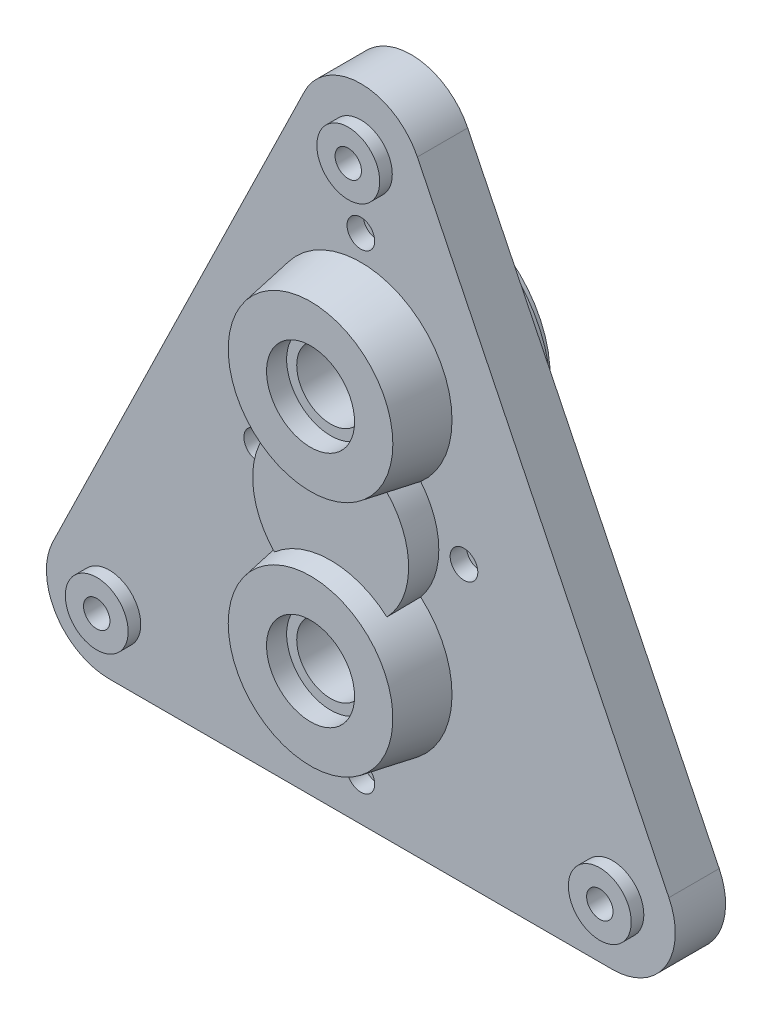
from build123d import *

# Parameters (mm, degrees)
SKETCH1_R                     = 5.25
BOSS_EXTRUDE1_DEPTH           = 20
BOSS_EXTRUDE2_DEPTH           = 10
BOSS_EXTRUDE3_DEPTH           = 15
SKETCH4_R                     = 36.25
BOSS_EXTRUDE4_DEPTH           = 20
BOSS_EXTRUDE4_DRAFT           = 10
BOSS_EXTRUDE4_PROFILE_2_DEPTH = 20
BOSS_EXTRUDE4_PROFILE_2_DRAFT = 10
SKETCH5_R                     = 12.5
BOSS_EXTRUDE5_DEPTH           = 5
CUT_EXTRUDE1_DEPTH            = 196.576072156
CUT_EXTRUDE1_DEPTH_BACK       = 196.576072156
SKETCH1_2_R                   = 5.25
BOSS_EXTRUDE6_START           = 12
SKETCH6_R                     = 31
BOSS_EXTRUDE6_DEPTH           = 12
CUT_EXTRUDE2_DEPTH            = 196.576072177
CUT_EXTRUDE2_DEPTH_BACK       = 196.576072177
SKETCH3_R                     = 13.5
SKETCH3_4_R                   = 18.5
SKETCH3_4_R_2                 = 13.5
CUT_EXTRUDE3_DEPTH            = 17
SKETCH3_5_R                   = 12
CUT_EXTRUDE4_DEPTH            = 15
SKETCH3_6_R                   = 15
SKETCH3_6_R_2                 = 12
CUT_EXTRUDE5_DEPTH            = 13
SKETCH7_R                     = 17.5
CUT_EXTRUDE6_DEPTH            = 8
CUT_EXTRUDE7_DEPTH            = 198.863589399
CUT_EXTRUDE7_DEPTH_BACK       = 198.863589399
SKETCH8_R                     = 3
SKETCH9_R                     = 5.5
CUT_EXTRUDE8_DEPTH            = 6.5
SKETCH10_R                    = 12
CUT_EXTRUDE9_DEPTH            = 0.8


with BuildPart() as part:
    # Sketch1 → Boss-Extrude1 (new body)
    with BuildSketch(Plane.XY):
        with BuildLine():
            Line((-22.469211141, 130.960590801), (-122.469211141, -74.039409199))
            ThreePointArc((-122.469211141, -74.039409199), (-121.201589209, -98.247362567), (-100, -110))
            Line((-100, -110), (100, -110))
            ThreePointArc((100, -110), (121.201589209, -98.247362567), (122.469211141, -74.039409199))
            Line((122.469211141, -74.039409199), (22.469211141, 130.960590801))
            ThreePointArc((22.469211141, 130.960590801), (0, 145), (-22.469211141, 130.960590801))
        make_face()
        with Locations((0, 120)):
            Circle(SKETCH1_R, mode=Mode.SUBTRACT)
        with Locations((-100, -85)):
            Circle(SKETCH1_R, mode=Mode.SUBTRACT)
        with Locations((100, -85)):
            Circle(SKETCH1_R, mode=Mode.SUBTRACT)
    extrude(amount=BOSS_EXTRUDE1_DEPTH)

    # Sketch2 → Boss-Extrude2 (add)
    with BuildSketch(Plane.XY):
        with BuildLine():
            ThreePointArc((35.25918145, 18.888888889), (42.263103155, 63.417640882), (7.327935681, 91.902702703))
            ThreePointArc((7.327935681, 91.902702703), (0, 101), (-7.327935681, 91.902702703))
            ThreePointArc((-7.327935681, 91.902702703), (-42.263103155, 63.417640882), (-35.25918145, 18.888888889))
            ThreePointArc((-35.25918145, 18.888888889), (-37.73934661, 13.256761197), (-39.326219512, 7.310845292))
            ThreePointArc((-39.326219512, 7.310845292), (-48.5, 0), (-39.326219512, -7.310845292))
            ThreePointArc((-39.326219512, -7.310845292), (-37.73934661, -13.256761197), (-35.25918145, -18.888888889))
            ThreePointArc((-35.25918145, -18.888888889), (-42.263103155, -63.417640882), (-7.327935681, -91.902702703))
            ThreePointArc((-7.327935681, -91.902702703), (0, -101), (7.327935681, -91.902702703))
            ThreePointArc((7.327935681, -91.902702703), (42.263103155, -63.417640882), (35.25918145, -18.888888889))
            ThreePointArc((35.25918145, -18.888888889), (37.73934661, -13.256761197), (39.326219512, -7.310845292))
            ThreePointArc((39.326219512, -7.310845292), (48.5, 0), (39.326219512, 7.310845292))
            ThreePointArc((39.326219512, 7.310845292), (37.73934661, 13.256761197), (35.25918145, 18.888888889))
        make_face()
        with BuildLine():
            ThreePointArc((29.101779675, 19.444444444), (30.465124689, 17.230095115), (31.660300908, 14.920634921))
            ThreePointArc((31.660300908, 14.920634921), (34.903399249, -2.598599792), (29.101779675, -19.444444444))
            ThreePointArc((29.101779675, -19.444444444), (0, -87.5), (-29.101779675, -19.444444444))
            ThreePointArc((-29.101779675, -19.444444444), (-35, 0), (-29.101779675, 19.444444444))
            ThreePointArc((-29.101779675, 19.444444444), (0, 87.5), (29.101779675, 19.444444444))
        make_face(mode=Mode.SUBTRACT)
    extrude(amount=-BOSS_EXTRUDE2_DEPTH)

    # Sketch2<3> → Boss-Extrude3 (add)
    with BuildSketch(Plane.XY):
        with BuildLine():
            ThreePointArc((29.101779675, -19.444444444), (34.903399249, -2.598599792), (31.660300908, 14.920634921))
            ThreePointArc((31.660300908, 14.920634921), (30.465124689, 17.230095115), (29.101779675, 19.444444444))
            ThreePointArc((29.101779675, 19.444444444), (0, 87.5), (-29.101779675, 19.444444444))
            ThreePointArc((-29.101779675, 19.444444444), (-35, 0), (-29.101779675, -19.444444444))
            ThreePointArc((-29.101779675, -19.444444444), (0, -87.5), (29.101779675, -19.444444444))
        make_face()
        with BuildLine():
            ThreePointArc((-23.778816177, 19.888888889), (0, 83.5), (23.778816177, 19.888888889))
            ThreePointArc((23.778816177, 19.888888889), (26.440566518, 16.183214829), (28.5295681, 12.126984127))
            ThreePointArc((28.5295681, 12.126984127), (30.664242982, -4.550187067), (23.778816177, -19.888888889))
            ThreePointArc((23.778816177, -19.888888889), (0, -83.5), (-23.778816177, -19.888888889))
            ThreePointArc((-23.778816177, -19.888888889), (-31, 0), (-23.778816177, 19.888888889))
        make_face(mode=Mode.SUBTRACT)
    extrude(amount=-BOSS_EXTRUDE3_DEPTH)


with BuildPart() as boss_extrude4_tool:
    # Sketch4 → Boss-Extrude4 (with draft: the straight prism first)
    with BuildSketch(Plane.XY.offset(20)):
        with Locations((0, 47.25)):
            Circle(SKETCH4_R)
    extrude(amount=BOSS_EXTRUDE4_DEPTH)
    # Boss-Extrude4: the draft: its side faces are tilted about the plane it starts from
    boss_extrude4_sides = [boss_extrude4_tool.faces().sort_by_distance(p)[0] for p in [
        (-36.25, 47.25, 30),
    ]]
    draft(boss_extrude4_sides, Plane.XY.offset(20), BOSS_EXTRUDE4_DRAFT)


with BuildPart() as part_1:
    add(part.part)

    # Boss-Extrude4: add boss_extrude4_tool
    add(boss_extrude4_tool.part)


with BuildPart() as boss_extrude4_profile_2_tool:
    # Sketch4 → Boss-Extrude4 profile 2 (with draft: the straight prism first)
    with BuildSketch(Plane.XY.offset(20)):
        with Locations((0, -47.25)):
            Circle(SKETCH4_R)
    extrude(amount=BOSS_EXTRUDE4_PROFILE_2_DEPTH)
    # Boss-Extrude4 profile 2: the draft: its side faces are tilted about the plane it starts from
    boss_extrude4_profile_2_sides = [boss_extrude4_profile_2_tool.faces().sort_by_distance(p)[0] for p in [
        (-36.25, -47.25, 30),
    ]]
    draft(boss_extrude4_profile_2_sides, Plane.XY.offset(20), BOSS_EXTRUDE4_PROFILE_2_DRAFT)


with BuildPart() as part_2:
    add(part_1.part)

    # Boss-Extrude4 profile 2: add boss_extrude4_profile_2_tool
    add(boss_extrude4_profile_2_tool.part)

    # Sketch5 → Boss-Extrude5 (add)
    with BuildSketch(Plane.XY.offset(20)):
        with Locations((0, 120)):
            Circle(SKETCH5_R)
        with Locations((-100, -85)):
            Circle(SKETCH5_R)
        with Locations((100, -85)):
            Circle(SKETCH5_R)
    extrude(amount=BOSS_EXTRUDE5_DEPTH)

    # Sketch1<2> → Cut-Extrude1 (cut, two sides: drawn at the far end of the back side and taken through both)
    with BuildSketch(Plane.XY.offset(-CUT_EXTRUDE1_DEPTH_BACK)):
        with Locations((0, 120)):
            Circle(SKETCH1_2_R)
        with Locations((-100, -85)):
            Circle(SKETCH1_2_R)
        with Locations((100, -85)):
            Circle(SKETCH1_2_R)
    extrude(amount=CUT_EXTRUDE1_DEPTH + CUT_EXTRUDE1_DEPTH_BACK, mode=Mode.SUBTRACT)

    # Sketch6 → Boss-Extrude6 (add)
    with BuildSketch(Plane.XY.offset(20).offset(BOSS_EXTRUDE6_START)):
        Circle(SKETCH6_R)
    extrude(amount=-BOSS_EXTRUDE6_DEPTH)

    # Sketch3 → Cut-Extrude2 (cut, two sides: drawn at the far end of the back side and taken through both)
    with BuildSketch(Plane(origin=(0, 0, 0), x_dir=(-1, 0, 0), z_dir=(0, 0, -1)).offset(-CUT_EXTRUDE2_DEPTH_BACK)):
        with Locations((0, 47.25)):
            Circle(SKETCH3_R)
        with Locations((0, -47.25)):
            Circle(SKETCH3_R)
    extrude(amount=CUT_EXTRUDE2_DEPTH + CUT_EXTRUDE2_DEPTH_BACK, mode=Mode.SUBTRACT)

    # Sketch3<4> → Cut-Extrude3 (cut)
    # profile 1 of 2: a face of its own
    with BuildSketch(Plane(origin=(0, 0, 0), x_dir=(-1, 0, 0), z_dir=(0, 0, -1))):
        with Locations((0, 47.25)):
            Circle(SKETCH3_4_R)
        with Locations((0, 47.25)):
            Circle(SKETCH3_4_R_2, mode=Mode.SUBTRACT)
    # profile 2 of 2: a face of its own
    with BuildSketch(Plane(origin=(0, 0, 0), x_dir=(-1, 0, 0), z_dir=(0, 0, -1))):
        with Locations((0, -47.25)):
            Circle(SKETCH3_4_R)
        with Locations((0, -47.25)):
            Circle(SKETCH3_4_R_2, mode=Mode.SUBTRACT)
    extrude(amount=-CUT_EXTRUDE3_DEPTH, mode=Mode.SUBTRACT)

    # Sketch3<5> → Cut-Extrude4 (cut)
    with BuildSketch(Plane(origin=(0, 0, 0), x_dir=(-1, 0, 0), z_dir=(0, 0, -1))):
        Circle(SKETCH3_5_R)
    extrude(amount=-CUT_EXTRUDE4_DEPTH, mode=Mode.SUBTRACT)

    # Sketch3<6> → Cut-Extrude5 (cut)
    with BuildSketch(Plane(origin=(0, 0, 0), x_dir=(-1, 0, 0), z_dir=(0, 0, -1))):
        Circle(SKETCH3_6_R)
        Circle(SKETCH3_6_R_2, mode=Mode.SUBTRACT)
    extrude(amount=-CUT_EXTRUDE5_DEPTH, mode=Mode.SUBTRACT)

    # Sketch7 → Cut-Extrude6 (cut)
    with BuildSketch(Plane.XY.offset(40)):
        with Locations((0, 47.25)):
            Circle(SKETCH7_R)
        with Locations((0, -47.25)):
            Circle(SKETCH7_R)
    extrude(amount=-CUT_EXTRUDE6_DEPTH, mode=Mode.SUBTRACT)

    # Sketch8 → Cut-Extrude7 (cut, two sides: drawn at the far end of the back side and taken through both)
    with BuildSketch(Plane(origin=(0, 0, -10), x_dir=(-1, 0, 0), z_dir=(0, 0, -1)).offset(-CUT_EXTRUDE7_DEPTH_BACK)):
        with Locations((0, 93.5)):
            Circle(SKETCH8_R)
        with Locations((41, 0)):
            Circle(SKETCH8_R)
        with Locations((0, -93.5)):
            Circle(SKETCH8_R)
        with Locations((-41, 0)):
            Circle(SKETCH8_R)
    extrude(amount=CUT_EXTRUDE7_DEPTH + CUT_EXTRUDE7_DEPTH_BACK, mode=Mode.SUBTRACT)

    # Sketch9 → Cut-Extrude8 (cut)
    with BuildSketch(Plane.XY.offset(20)):
        with Locations((0, 93.5)):
            Circle(SKETCH9_R)
        with Locations((-41, 0)):
            Circle(SKETCH9_R)
        with Locations((41, 0)):
            Circle(SKETCH9_R)
        with Locations((0, -93.5)):
            Circle(SKETCH9_R)
    extrude(amount=-CUT_EXTRUDE8_DEPTH, mode=Mode.SUBTRACT)

    # Sketch10 → Cut-Extrude9 (cut)
    with BuildSketch(Plane(origin=(0, 0, 0), x_dir=(-1, 0, 0), z_dir=(0, 0, -1))):
        with Locations((0, 120)):
            Circle(SKETCH10_R)
        with Locations((100, -85)):
            Circle(SKETCH10_R)
        with Locations((-100, -85)):
            Circle(SKETCH10_R)
    extrude(amount=-CUT_EXTRUDE9_DEPTH, mode=Mode.SUBTRACT)


solid = part_2.part
